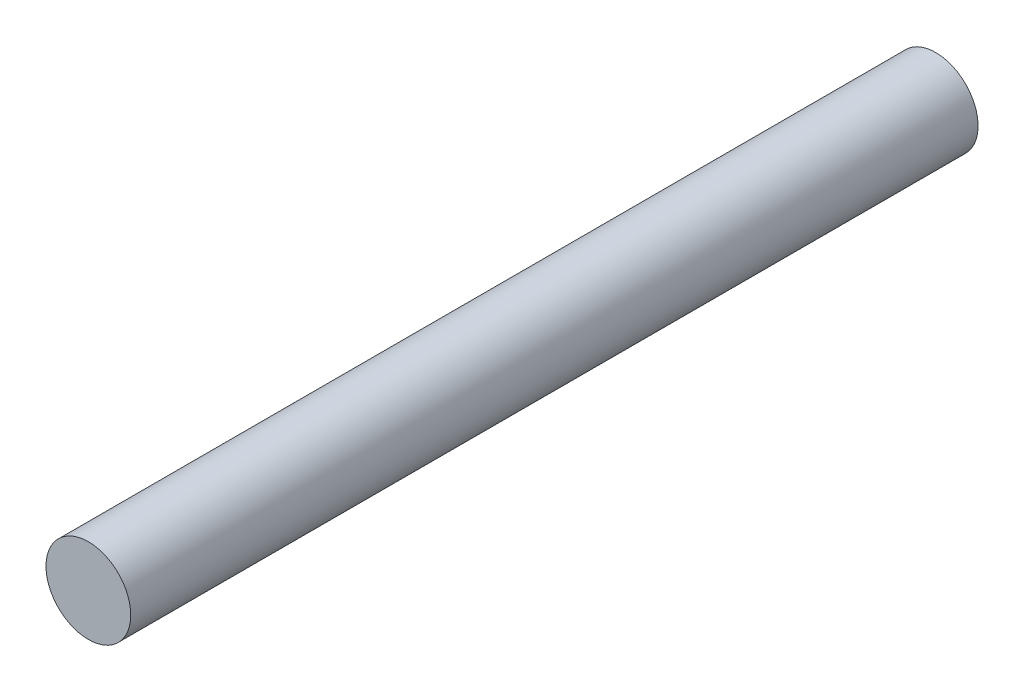
from build123d import *

# Parameters (mm, degrees)
BOSS_EXTRUDE1_DEPTH      = 76.2
BOSS_EXTRUDE1_DEPTH_BACK = 76.2
SKETCH3_R                = 6.35
SKETCH4_R                = 6.35
CUT_EXTRUDE1_DEPTH       = 25.4


with BuildPart() as part:
    # Sketch3 → Boss-Extrude1 (new, two sides: drawn at the far end of the back side and taken through both)
    with BuildSketch(Plane.XY.offset(-BOSS_EXTRUDE1_DEPTH_BACK)):
        Circle(SKETCH3_R)
    extrude(amount=BOSS_EXTRUDE1_DEPTH + BOSS_EXTRUDE1_DEPTH_BACK)

    # Sketch4 → Cut-Extrude1 (cut)
    with BuildSketch(Plane(origin=(0, 0, -76.2), x_dir=(-1, 0, 0), z_dir=(0, 0, -1))):
        Circle(SKETCH4_R)
    extrude(amount=-CUT_EXTRUDE1_DEPTH, mode=Mode.SUBTRACT)


solid = part.part
